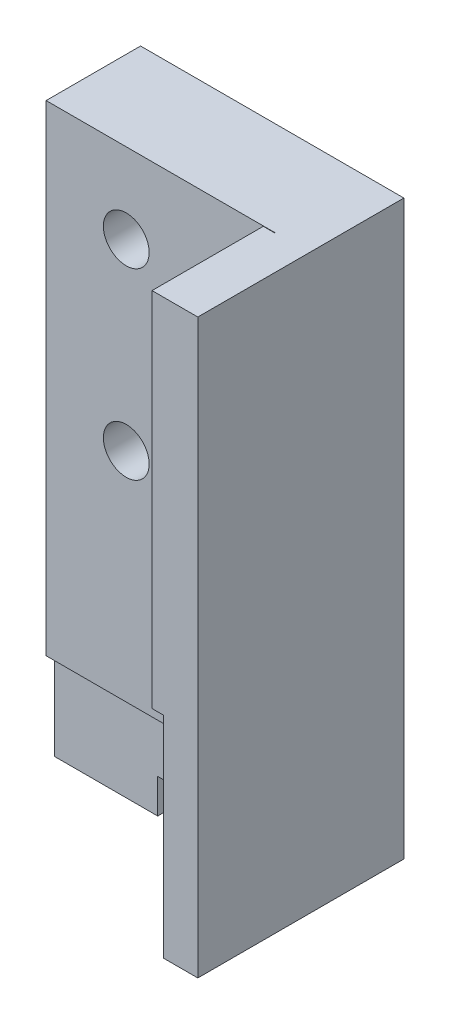
from build123d import *

# Parameters (mm, degrees)
BOSS_EXTRUDE1_DEPTH = 50
SKETCH4_W           = 20
SKETCH4_H           = 1.5
CUT_EXTRUDE1_DEPTH  = 8
SKETCH5_R           = 0.5
CUT_EXTRUDE2_DEPTH  = 8
SKETCH6_W           = 3
SKETCH6_H           = 3
CUT_EXTRUDE3_DEPTH  = 7.5
SKETCH7_R           = 2
CUT_EXTRUDE4_DEPTH  = 9
SKETCH8_W           = 20
SKETCH8_H           = 42
CUT_EXTRUDE5_DEPTH  = 0.75
SKETCH9_W           = 9.72
SKETCH9_H           = 31.616710758
BOSS_EXTRUDE2_DEPTH = 1


with BuildPart() as part:
    # Sketch3 → Boss-Extrude1 (new body)
    with BuildSketch(Plane(origin=(0, 0, 0), x_dir=(1, 0, 0), z_dir=(0, 1, 0))):
        Polygon((0, 0), (0, 9), (23, 9), (23, -9), (20, -9), (20, 0), align=None)
    extrude(amount=BOSS_EXTRUDE1_DEPTH)

    # Sketch4 → Cut-Extrude1 (cut)
    with BuildSketch(Plane.XZ):
        with Locations((10, -0.75)):
            Rectangle(SKETCH4_W, SKETCH4_H)
    extrude(amount=-CUT_EXTRUDE1_DEPTH, mode=Mode.SUBTRACT)

    # Sketch5 → Cut-Extrude2 (cut)
    with BuildSketch(Plane.XZ):
        with Locations(Location((5, -5.5, 0), (0, 0, 270))):
            Circle(SKETCH5_R)
        with Locations(Location((15, -5.5, 0), (0, 0, 270))):
            Circle(SKETCH5_R)
    extrude(amount=-CUT_EXTRUDE2_DEPTH, mode=Mode.SUBTRACT)

    # Sketch6 → Cut-Extrude3 (cut)
    with BuildSketch(Plane.XY.offset(-1.5)):
        with Locations((10.5, 1.5)):
            Rectangle(SKETCH6_W, SKETCH6_H)
    extrude(amount=-CUT_EXTRUDE3_DEPTH, mode=Mode.SUBTRACT)

    # Sketch7 → Cut-Extrude4 (cut)
    with BuildSketch(Plane(origin=(0, 0, -9), x_dir=(-1, 0, 0), z_dir=(0, 0, -1))):
        with Locations((-7, 27)):
            Circle(SKETCH7_R)
        with Locations((-7, 43)):
            Circle(SKETCH7_R)
    extrude(amount=-CUT_EXTRUDE4_DEPTH, mode=Mode.SUBTRACT)

    # Sketch8 → Cut-Extrude5 (cut)
    with BuildSketch(Plane.XY):
        with Locations((10, 29)):
            Rectangle(SKETCH8_W, SKETCH8_H)
    extrude(amount=-CUT_EXTRUDE5_DEPTH, mode=Mode.SUBTRACT)

    # Sketch9 → Boss-Extrude2 (add)
    with BuildSketch(Plane.ZY.offset(-20)):
        with Locations((4.14, 34.191644621)):
            Rectangle(SKETCH9_W, SKETCH9_H)
    extrude(amount=BOSS_EXTRUDE2_DEPTH)


solid = part.part
